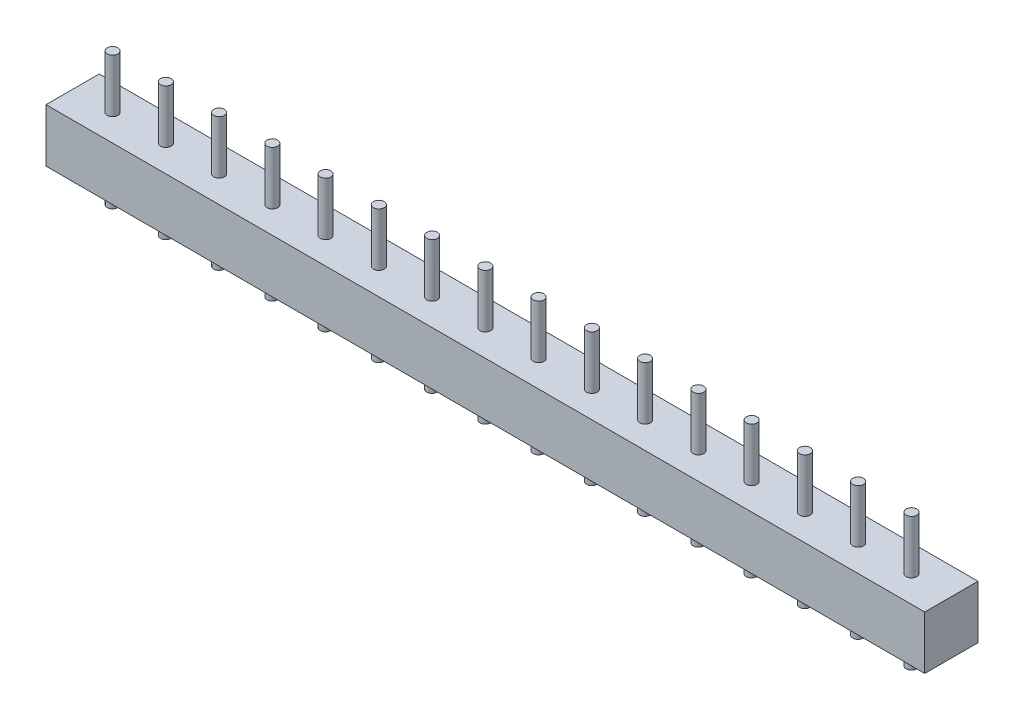
from build123d import *

# Parameters (mm, degrees)
SKETCH1_W      = 41.91
SKETCH1_H      = 2.54
EXTRUDE1_DEPTH = 2.54
SKETCH2_R      = 0.254
EXTRUDE2_DEPTH = 1.27
EXTRUDE4_START = 2.54
SKETCH3_R      = 0.254
EXTRUDE4_DEPTH = 2.54


with BuildPart() as part:
    # Sketch1 → Extrude1 (new body)
    with BuildSketch(Plane(origin=(0, 0, 0), x_dir=(1, 0, 0), z_dir=(0, 1, 0))):
        Rectangle(SKETCH1_W, SKETCH1_H)
    extrude(amount=EXTRUDE1_DEPTH)

    # Sketch2 → Extrude2 (add)
    with BuildSketch(Plane(origin=(0, 0, 0), x_dir=(1, 0, 0), z_dir=(0, 1, 0))):
        with Locations(Location((19.05, 0, 0), (0, 0, 270))):
            Circle(SKETCH2_R)
        with Locations(Location((16.51, 0, 0), (0, 0, 270))):
            Circle(SKETCH2_R)
        with Locations(Location((13.97, 0, 0), (0, 0, 270))):
            Circle(SKETCH2_R)
        with Locations(Location((11.43, 0, 0), (0, 0, 270))):
            Circle(SKETCH2_R)
        with Locations(Location((8.89, 0, 0), (0, 0, 270))):
            Circle(SKETCH2_R)
        with Locations(Location((6.35, 0, 0), (0, 0, 270))):
            Circle(SKETCH2_R)
        with Locations(Location((3.81, 0, 0), (0, 0, 270))):
            Circle(SKETCH2_R)
        with Locations(Location((1.27, 0, 0), (0, 0, 270))):
            Circle(SKETCH2_R)
        with Locations(Location((-1.27, 0, 0), (0, 0, 270))):
            Circle(SKETCH2_R)
        with Locations(Location((-3.81, 0, 0), (0, 0, 270))):
            Circle(SKETCH2_R)
        with Locations(Location((-6.35, 0, 0), (0, 0, 270))):
            Circle(SKETCH2_R)
        with Locations(Location((-8.89, 0, 0), (0, 0, 270))):
            Circle(SKETCH2_R)
        with Locations(Location((-11.43, 0, 0), (0, 0, 270))):
            Circle(SKETCH2_R)
        with Locations(Location((-13.97, 0, 0), (0, 0, 270))):
            Circle(SKETCH2_R)
        with Locations(Location((-16.51, 0, 0), (0, 0, 270))):
            Circle(SKETCH2_R)
        with Locations(Location((-19.05, 0, 0), (0, 0, 270))):
            Circle(SKETCH2_R)
    extrude(amount=-EXTRUDE2_DEPTH)

    # Sketch3 → Extrude4 (add)
    with BuildSketch(Plane(origin=(0, 2.54, 0), x_dir=(1, 0, 0), z_dir=(0, 1, 0)).offset(EXTRUDE4_START)):
        with Locations(Location((6.35, 0, 0), (0, 0, 270))):
            Circle(SKETCH3_R)
        with Locations(Location((8.89, 0, 0), (0, 0, 270))):
            Circle(SKETCH3_R)
        with Locations(Location((11.43, 0, 0), (0, 0, 270))):
            Circle(SKETCH3_R)
        with Locations(Location((13.97, 0, 0), (0, 0, 270))):
            Circle(SKETCH3_R)
        with Locations(Location((16.51, 0, 0), (0, 0, 270))):
            Circle(SKETCH3_R)
        with Locations(Location((19.05, 0, 0), (0, 0, 270))):
            Circle(SKETCH3_R)
        with Locations(Location((-13.97, 0, 0), (0, 0, 270))):
            Circle(SKETCH3_R)
        with Locations(Location((-11.43, 0, 0), (0, 0, 270))):
            Circle(SKETCH3_R)
        with Locations(Location((-8.89, 0, 0), (0, 0, 270))):
            Circle(SKETCH3_R)
        with Locations(Location((-6.35, 0, 0), (0, 0, 270))):
            Circle(SKETCH3_R)
        with Locations(Location((-3.81, 0, 0), (0, 0, 270))):
            Circle(SKETCH3_R)
        with Locations(Location((-1.27, 0, 0), (0, 0, 270))):
            Circle(SKETCH3_R)
        with Locations(Location((1.27, 0, 0), (0, 0, 270))):
            Circle(SKETCH3_R)
        with Locations(Location((3.81, 0, 0), (0, 0, 270))):
            Circle(SKETCH3_R)
        with Locations(Location((-19.05, 0, 0), (0, 0, 270))):
            Circle(SKETCH3_R)
        with Locations(Location((-16.51, 0, 0), (0, 0, 270))):
            Circle(SKETCH3_R)
    extrude(amount=-EXTRUDE4_DEPTH)


solid = part.part
